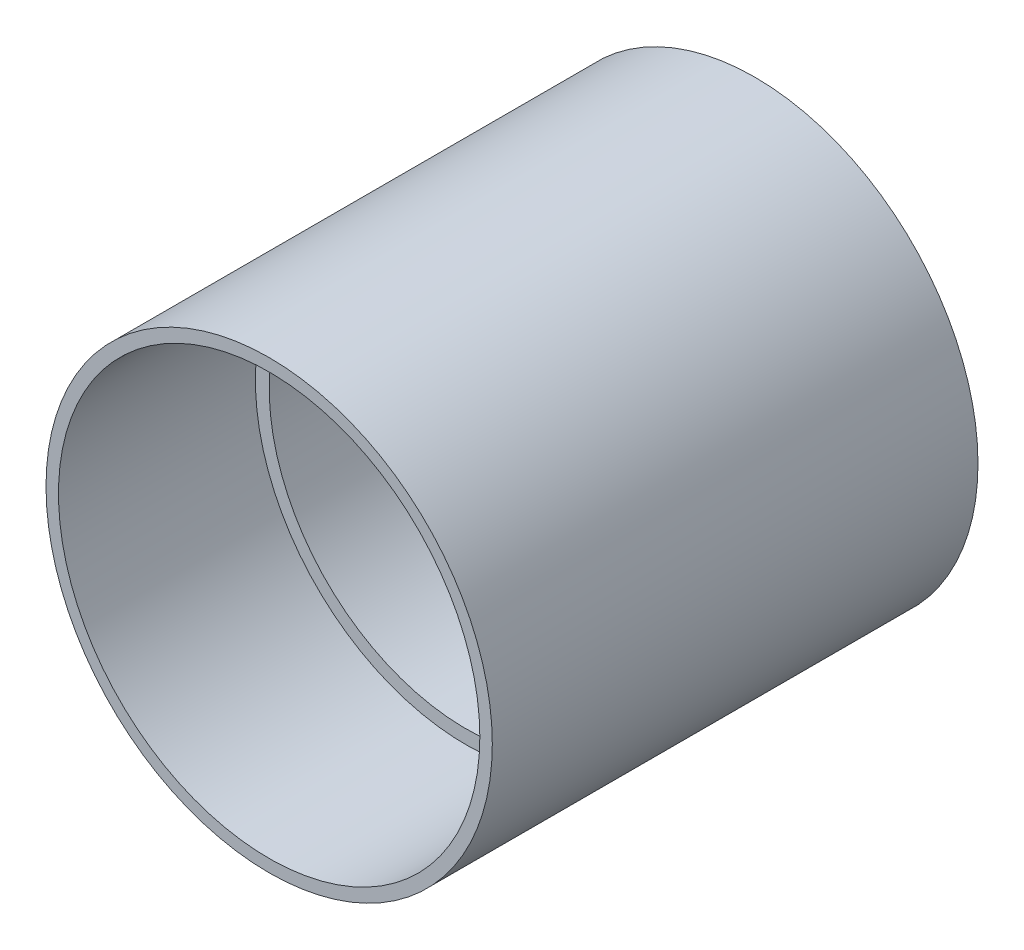
from build123d import *

# Parameters (mm, degrees)
SKETCH1_R         = 34
BODY_DEPTH        = 74
SKETCH2_R         = 32.1
SLEEVE_BORE_DEPTH = 30
SKETCH3_R         = 30
CHAMBER_DEPTH     = 40
BASE_CORNER_R     = 2


with BuildPart() as part:
    # Sketch1 → Body (new body)
    with BuildSketch(Plane.XY):
        Circle(SKETCH1_R)
    extrude(amount=BODY_DEPTH)

    # Sketch2 → Sleeve_bore (cut)
    with BuildSketch(Plane.XY.offset(44)):
        Circle(SKETCH2_R)
    extrude(amount=SLEEVE_BORE_DEPTH, mode=Mode.SUBTRACT)

    # Sketch3 → Chamber (cut)
    with BuildSketch(Plane.XY.offset(4)):
        Circle(SKETCH3_R)
    extrude(amount=CHAMBER_DEPTH, mode=Mode.SUBTRACT)

    # Base_corner
    base_corner_edges = [part.edges().sort_by_distance(p)[0] for p in [
        (-30, 0, 4),
    ]]
    fillet(base_corner_edges, radius=BASE_CORNER_R)


solid = part.part
